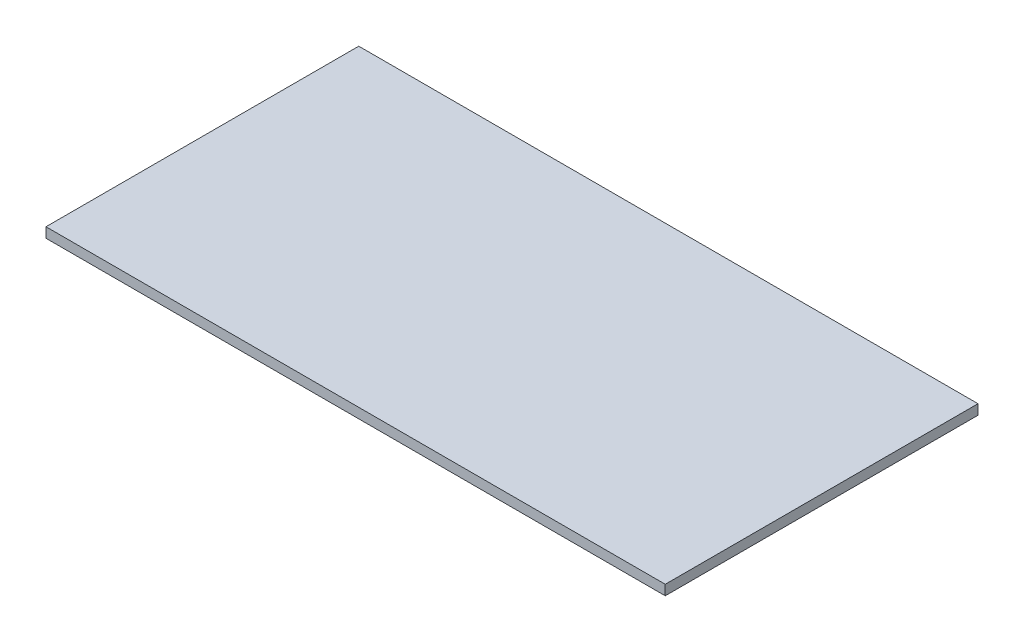
from build123d import *

# Parameters (mm, degrees)
SKETCH1_W           = 99
SKETCH1_H           = 50
BOSS_EXTRUDE1_DEPTH = 1.6


with BuildPart() as part:
    # Sketch1 → Boss-Extrude1 (new body)
    with BuildSketch(Plane(origin=(0, 0, 0), x_dir=(1, 0, 0), z_dir=(0, 1, 0))):
        with Locations((-3.558823529, -8.014705882)):
            Rectangle(SKETCH1_W, SKETCH1_H)
    extrude(amount=BOSS_EXTRUDE1_DEPTH)


solid = part.part
